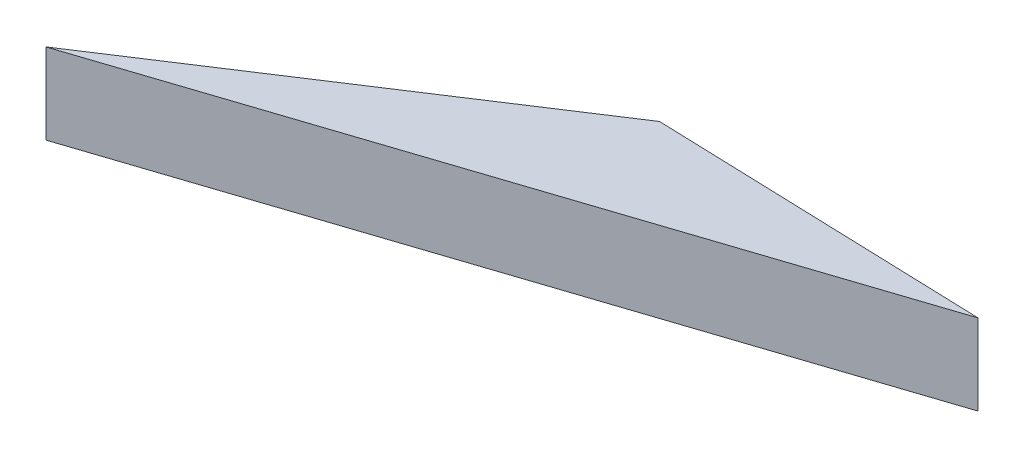
from build123d import *

# Parameters (mm, degrees)
SKETCH1_W           = 2300
SKETCH1_H           = 150
BOSS_EXTRUDE1_DEPTH = 50
SKETCH2_OUTSIDE_W   = 2763.086
SKETCH2_OUTSIDE_H   = 613.086
CUT_EXTRUDE1_DEPTH  = 2306.42837668


with BuildPart() as part:
    # Sketch1 → Boss-Extrude1 (new body)
    with BuildSketch(Plane(origin=(0, 0, 0), x_dir=(1, 0, 0), z_dir=(0, 1, 0))):
        with Locations((1150, 75)):
            Rectangle(SKETCH1_W, SKETCH1_H)
    extrude(amount=BOSS_EXTRUDE1_DEPTH)

    # Sketch2 outside → Cut-Extrude1 (cut, through all)
    with BuildSketch(Plane(origin=(0, 50, 0), x_dir=(1, 0, 0), z_dir=(0, 1, 0))):
        with Locations((1150, 75)):
            Rectangle(SKETCH2_OUTSIDE_W, SKETCH2_OUTSIDE_H)
        Polygon((0, 0), (230, 150), (433.953035654, 143.274598577), align=None, mode=Mode.SUBTRACT)
    extrude(amount=-CUT_EXTRUDE1_DEPTH, mode=Mode.SUBTRACT)


solid = part.part
